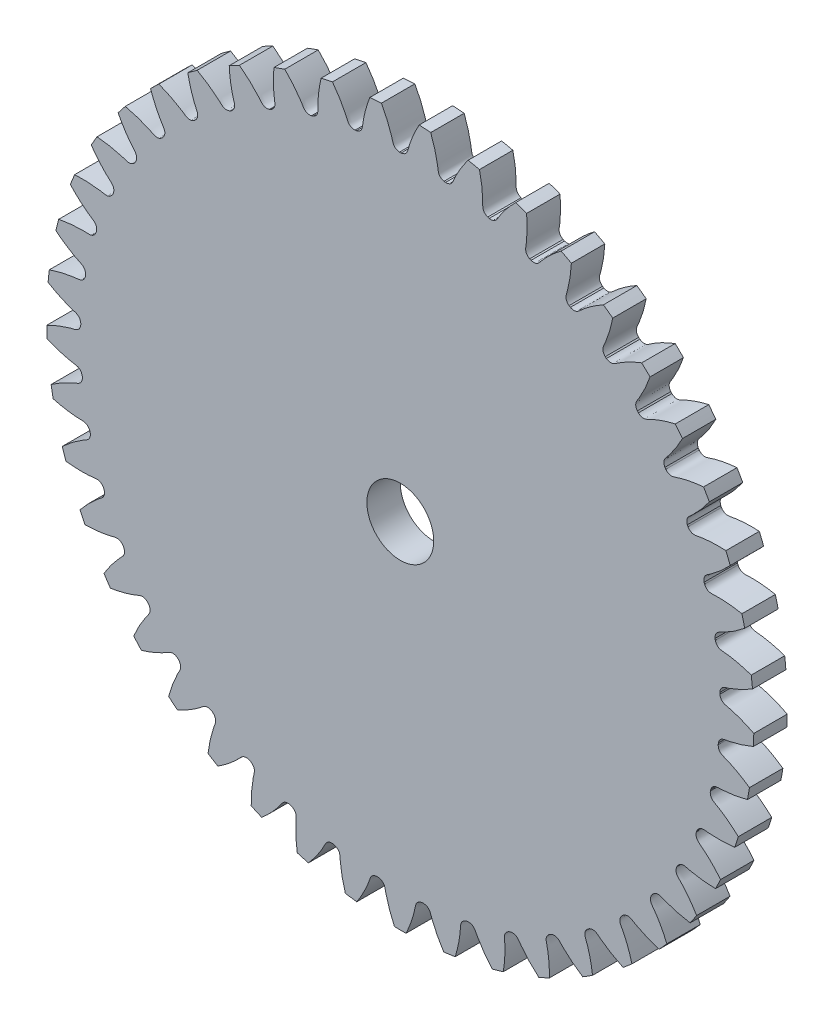
from build123d import *

# Parameters (mm, degrees)
SKETCH_1_R               = 10.575
EXTRUDE_1_DEPTH          = 1
CUT_EXTRUDE_1_DEPTH      = 15.98870408
PATTERN_CIRCULAR_1_COUNT = 45
SKETCH_4_R               = 1
CUT_EXTRUDE_2_DEPTH      = 15.987419743


with BuildPart() as part:
    # 草图1 → 凸台-拉伸1 (new body)
    with BuildSketch(Plane.XY):
        Circle(SKETCH_1_R)
    extrude(amount=EXTRUDE_1_DEPTH)

    # 草图2 → 切除-拉伸1 (cut, through all)
    with BuildSketch(Plane.XY):
        with BuildLine():
            ThreePointArc((0.023342969, 9.562471509), (0, 9.5625), (-0.023342969, 9.562471509))
            add(Edge.make_bspline(
                [(-0.023342969, 9.562471509), (-0.199607461, 9.586844803), (-0.219626048, 9.717635684), (-0.261281558, 9.859317988), (-0.277284473, 9.910665665), (-0.295569165, 9.965264052), (-0.316205369, 10.023079098), (-0.33934814, 10.084025868), (-0.365124689, 10.14802913), (-0.393667642, 10.215005532), (-0.425105138, 10.28486891), (-0.459563583, 10.357528808), (-0.497166714, 10.432890989), (-0.538035727, 10.510857368), (-0.582289116, 10.591326115), (-0.630042583, 10.674191716), (-0.681408937, 10.759345045), (-0.736497994, 10.846673436), (-0.795416486, 10.936060765), (-0.858267962, 11.027387522), (-0.925152697, 11.1205309), (-0.996167604, 11.21536487), (-1.071406141, 11.311760275), (-1.150958233, 11.409584913), (-1.234910175, 11.508703628), (-1.323344571, 11.608978406), (-1.416340208, 11.710268464), (-1.548269118, 11.848318659), (-1.651688099, 11.950153131), (-1.722848965, 12.017545794)],
                knots=[0, 0, 0, 0, 0.112268392, 0.128789174, 0.146568276, 0.165605699, 0.185901442, 0.207455506, 0.23026789, 0.254338595, 0.27966762, 0.306254966, 0.334100632, 0.363204619, 0.393566926, 0.425187554, 0.458066503, 0.492203772, 0.527599361, 0.564253271, 0.602165502, 0.641336053, 0.681764924, 0.723452116, 0.766397629, 0.810601462, 0.856063616, 0.90278409, 1, 1, 1, 1], degree=3))
            ThreePointArc((-1.722848965, 12.017545794), (0, 12.140412492), (1.722848965, 12.017545794))
            add(Edge.make_bspline(
                [(0.023342969, 9.562471509), (0.199607461, 9.586844803), (0.219626048, 9.717635684), (0.261281558, 9.859317988), (0.277284473, 9.910665665), (0.295569165, 9.965264052), (0.316205369, 10.023079098), (0.33934814, 10.084025868), (0.365124689, 10.14802913), (0.393667642, 10.215005532), (0.425105138, 10.28486891), (0.459563583, 10.357528808), (0.497166714, 10.432890989), (0.538035727, 10.510857368), (0.582289116, 10.591326115), (0.630042583, 10.674191716), (0.681408937, 10.759345045), (0.736497994, 10.846673436), (0.795416486, 10.936060765), (0.858267962, 11.027387522), (0.925152697, 11.1205309), (0.996167604, 11.21536487), (1.071406141, 11.311760275), (1.150958233, 11.409584913), (1.234910175, 11.508703628), (1.323344571, 11.608978406), (1.416340208, 11.710268464), (1.548269118, 11.848318659), (1.651688099, 11.950153131), (1.722848965, 12.017545794)],
                knots=[0, 0, 0, 0, 0.112268392, 0.128789174, 0.146568276, 0.165605699, 0.185901442, 0.207455506, 0.23026789, 0.254338595, 0.27966762, 0.306254966, 0.334100632, 0.363204619, 0.393566926, 0.425187554, 0.458066503, 0.492203772, 0.527599361, 0.564253271, 0.602165502, 0.641336053, 0.681764924, 0.723452116, 0.766397629, 0.810601462, 0.856063616, 0.90278409, 1, 1, 1, 1], degree=3))
        make_face()
    cut_extrude_1 = extrude(amount=CUT_EXTRUDE_1_DEPTH, mode=Mode.SUBTRACT)

    # 阵列(圆周)1: 切除-拉伸1 ×45 about axis
    pattern_circular_1_axis = Axis((0, 0, 1), (0, 0, -1))
    for i in range(1, PATTERN_CIRCULAR_1_COUNT):
        add(cut_extrude_1.rotate(pattern_circular_1_axis, i * 360 / PATTERN_CIRCULAR_1_COUNT), mode=Mode.SUBTRACT)

    # 草图4 → 切除-拉伸2 (cut, through all)
    with BuildSketch(Plane.XY.offset(1)):
        Circle(SKETCH_4_R)
    extrude(amount=-CUT_EXTRUDE_2_DEPTH, mode=Mode.SUBTRACT)


solid = part.part
